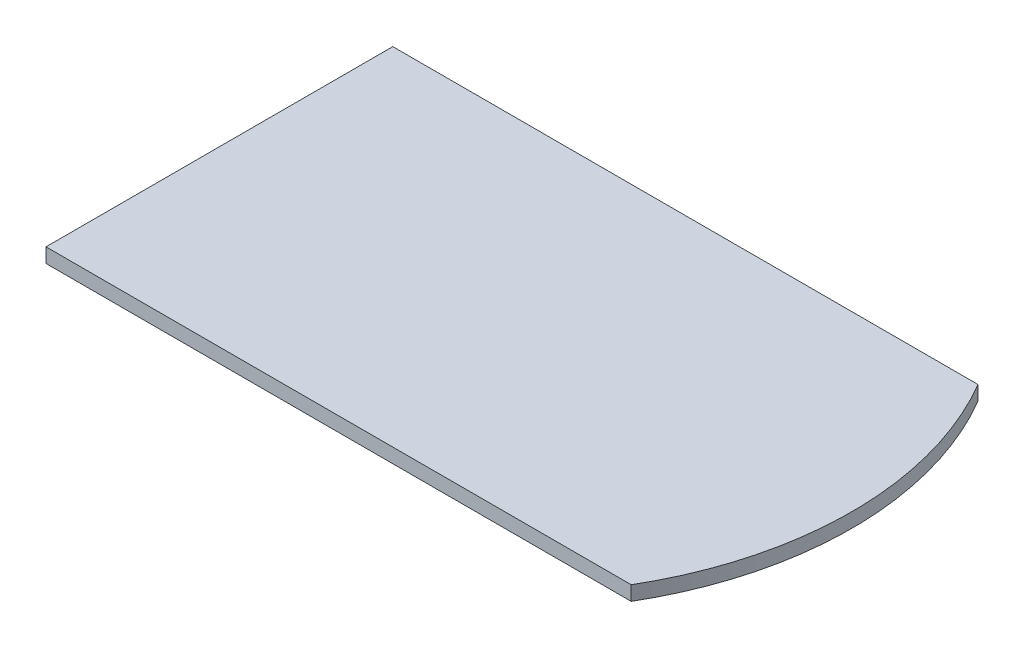
from build123d import *

# Parameters (mm, degrees)
BOSS_EXTRUDE1_DEPTH = 4


with BuildPart() as part:
    # Sketch1 → Boss-Extrude1 (new body)
    with BuildSketch(Plane(origin=(0, 0, 0), x_dir=(1, 0, 0), z_dir=(0, 1, 0))):
        with BuildLine():
            Line((0, 0), (162, 0))
            ThreePointArc((162, 0), (175.047195741, -48), (162, -96))
            Line((162, -96), (0, -96))
            Line((0, -96), (0, 0))
        make_face()
    extrude(amount=BOSS_EXTRUDE1_DEPTH)


solid = part.part
